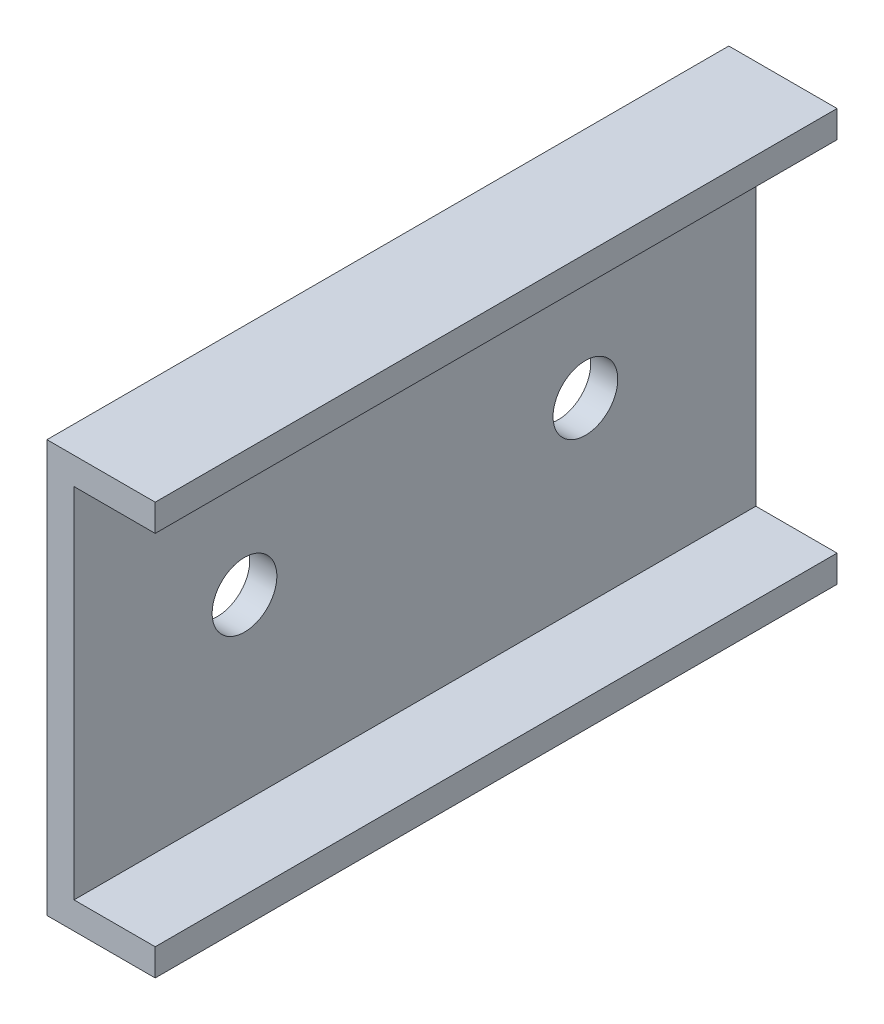
from build123d import *

# Parameters (mm, degrees)
BOSS_EXTRUDE1_DEPTH   = 20
F_6_CLEARANCE_HOLE1_D = 3.7973


with BuildPart() as part:
    # Sketch1 → Boss-Extrude1 (new body)
    with BuildSketch(Plane.XY):
        Polygon((0, 0), (6.35, 0), (6.35, 1.5875), (1.5875, 1.5875), (1.5875, 22.5875), (6.35, 22.5875), (6.35, 24.175), (0, 24.175), align=None)
    boss_extrude1 = extrude(amount=BOSS_EXTRUDE1_DEPTH)

    # #6 Clearance Hole1 (through all)
    with Locations(Plane.ZY):
        with Locations((10, 12.0875)):
            f_6_clearance_hole1 = Hole(F_6_CLEARANCE_HOLE1_D / 2)

    # Mirror1: Boss-Extrude1, #6 Clearance Hole1 across plane
    add(boss_extrude1.mirror(Plane(origin=(0, 0, 0), x_dir=(1, 0, 0), z_dir=(0, 0, -1))))
    add(f_6_clearance_hole1.mirror(Plane(origin=(0, 0, 0), x_dir=(1, 0, 0), z_dir=(0, 0, -1))), mode=Mode.SUBTRACT)


solid = part.part
